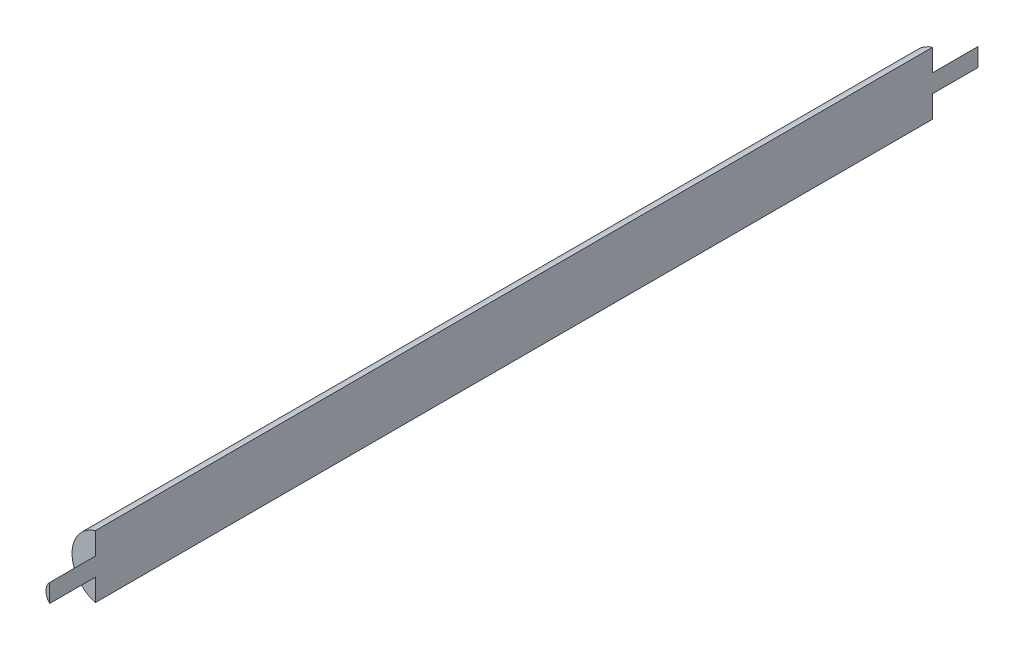
from build123d import *

# Parameters (mm, degrees)
SKIZZE1_R                            = 3.5
AUFSATZ_LINEAR_AUSTRAGEN1_DEPTH      = 90
SKIZZE3_R                            = 1.4
AUFSATZ_LINEAR_AUSTRAGEN2_DEPTH      = 4.9
AUFSATZ_LINEAR_START                 = 4.9
SKIZZE4_R                            = 1.4
AUFSATZ_LINEAR_AUSTRAGEN3_DEPTH      = 4.9
SCHNITT_LINEAR_AUSTRAGEN1_DEPTH      = 96.028995575
SCHNITT_LINEAR_AUSTRAGEN1_DEPTH_BACK = 96.028995575
SKIZZE5_W                            = 2
SKIZZE5_H                            = 8.003816725
SCHNITT_LINEAR_AUSTRAGEN2_DEPTH      = 96.023733877
SCHNITT_LINEAR_AUSTRAGEN2_DEPTH_BACK = 96.023733877
SKIZZE6_W                            = 3.926264937
SKIZZE6_H                            = 7.51599288


with BuildPart() as part:
    # Skizze1 → Aufsatz-Linear austragen1 (new body)
    with BuildSketch(Plane.XY):
        with Locations(Location((0, 0, 0), (0, 0, 180))):
            Circle(SKIZZE1_R)
    extrude(amount=AUFSATZ_LINEAR_AUSTRAGEN1_DEPTH)

    # Skizze3 → Aufsatz-Linear austragen2 (add)
    with BuildSketch(Plane.XY.offset(90)):
        Circle(SKIZZE3_R)
    extrude(amount=AUFSATZ_LINEAR_AUSTRAGEN2_DEPTH)

    # Skizze4 → Aufsatz-Linear austragen3 (add)
    with BuildSketch(Plane(origin=(0, 0, 0), x_dir=(-1, 0, 0), z_dir=(0, 0, -1)).offset(AUFSATZ_LINEAR_START)):
        with Locations(Location((0, 0, 0), (0, 0, 180))):
            Circle(SKIZZE4_R)
    extrude(amount=-AUFSATZ_LINEAR_AUSTRAGEN3_DEPTH)

    # Skizze5 → Schnitt-Linear austragen1 (cut, two sides: drawn at the far end of the back side and taken through both)
    with BuildSketch(Plane.XY.offset(90).offset(-SCHNITT_LINEAR_AUSTRAGEN1_DEPTH_BACK)):
        with Locations((0, -0.133552217)):
            Rectangle(SKIZZE5_W, SKIZZE5_H)
    extrude(amount=SCHNITT_LINEAR_AUSTRAGEN1_DEPTH + SCHNITT_LINEAR_AUSTRAGEN1_DEPTH_BACK, mode=Mode.SUBTRACT)


with BuildPart() as schnitt_linear_austragen1_piece_1:
    # of the separate pieces the step leaves, piece 1, a body of its own (schnitt_linear_austragen1_pieces)
    add(part.part.solids().sort_by_distance((-1, 3.354101966, 0))[0])


with BuildPart() as schnitt_linear_austragen1_piece_2:
    # of the separate pieces the step leaves, piece 2, a body of its own (schnitt_linear_austragen1_pieces)
    add(part.part.solids().sort_by_distance((1, -3.354101966, 0))[0])

    # Skizze6 → Schnitt-Linear austragen2 (cut, two sides: drawn at the far end of the back side and taken through both)
    with BuildSketch(Plane.XY.offset(90).offset(-SCHNITT_LINEAR_AUSTRAGEN2_DEPTH_BACK)):
        with Locations((2.16722224, 0.040063928)):
            Rectangle(SKIZZE6_W, SKIZZE6_H)
    extrude(amount=SCHNITT_LINEAR_AUSTRAGEN2_DEPTH + SCHNITT_LINEAR_AUSTRAGEN2_DEPTH_BACK, mode=Mode.SUBTRACT)


solid = schnitt_linear_austragen1_piece_1.part
